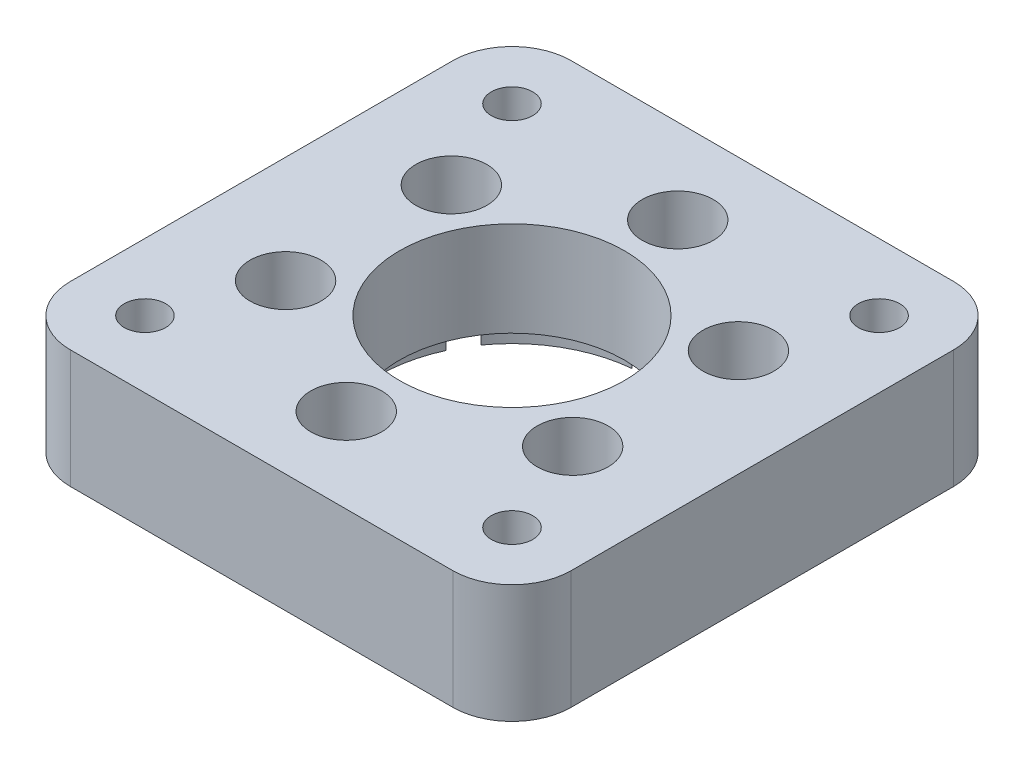
from build123d import *

# Parameters (mm, degrees)
SKETCH1_W           = 42.3
SKETCH1_H           = 42.3
BOSS_EXTRUDE1_DEPTH = 5
FILLET1_R           = 5
SKETCH2_R           = 1.75
CUT_EXTRUDE1_DEPTH  = 32.537992961
SKETCH3_R           = 11.25
CUT_EXTRUDE2_DEPTH  = 2
SKETCH4_R           = 9.5
CUT_EXTRUDE3_DEPTH  = 31.96199283
SKETCH5_R           = 3
CUT_EXTRUDE4_DEPTH  = 32.537992961
CIRPATTERN1_COUNT   = 6


with BuildPart() as part:
    # Sketch1 → Boss-Extrude1 (new, symmetric)
    with BuildSketch(Plane(origin=(0, 0, 0), x_dir=(1, 0, 0), z_dir=(0, 1, 0))):
        Rectangle(SKETCH1_W, SKETCH1_H)
    extrude(amount=BOSS_EXTRUDE1_DEPTH, both=True)

    # Fillet1
    fillet1_edges = [part.edges().sort_by_distance(p)[0] for p in [
        (21.15, 0, 21.15),
        (-21.15, 0, 21.15),
        (-21.15, 0, -21.15),
        (21.15, 0, -21.15),
    ]]
    fillet(fillet1_edges, radius=FILLET1_R)

    # Sketch2 → Cut-Extrude1 (cut, through all)
    with BuildSketch(Plane.XZ.offset(5)):
        with Locations(Location((-15.5, 15.5, 0), (0, 0, 270))):
            Circle(SKETCH2_R)
        with Locations(Location((15.5, 15.5, 0), (0, 0, 270))):
            Circle(SKETCH2_R)
        with Locations(Location((15.5, -15.5, 0), (0, 0, 270))):
            Circle(SKETCH2_R)
        with Locations(Location((-15.5, -15.5, 0), (0, 0, 270))):
            Circle(SKETCH2_R)
    extrude(amount=-CUT_EXTRUDE1_DEPTH, mode=Mode.SUBTRACT)

    # Sketch3 → Cut-Extrude2 (cut)
    with BuildSketch(Plane.XZ.offset(5)):
        with Locations(Location((0, 0, 0), (0, 0, 270))):
            Circle(SKETCH3_R)
    extrude(amount=-CUT_EXTRUDE2_DEPTH, mode=Mode.SUBTRACT)

    # Sketch4 → Cut-Extrude3 (cut, through all)
    with BuildSketch(Plane.XZ.offset(3)):
        with Locations(Location((0, 0, 0), (0, 0, 270))):
            Circle(SKETCH4_R)
    extrude(amount=-CUT_EXTRUDE3_DEPTH, mode=Mode.SUBTRACT)

    # Sketch5 → Cut-Extrude4 (cut, through all)
    with BuildSketch(Plane(origin=(0, 5, 0), x_dir=(1, 0, 0), z_dir=(0, 1, 0))):
        with Locations(Location((0, 14, 0), (0, 0, 270))):
            Circle(SKETCH5_R)
    cut_extrude4 = extrude(amount=-CUT_EXTRUDE4_DEPTH, mode=Mode.SUBTRACT)

    # CirPattern1: Cut-Extrude4 ×6 about axis
    cirpattern1_axis = Axis((0, 0, 0), (0, 1, 0))
    for i in range(1, CIRPATTERN1_COUNT):
        add(cut_extrude4.rotate(cirpattern1_axis, i * 360 / CIRPATTERN1_COUNT), mode=Mode.SUBTRACT)


solid = part.part
